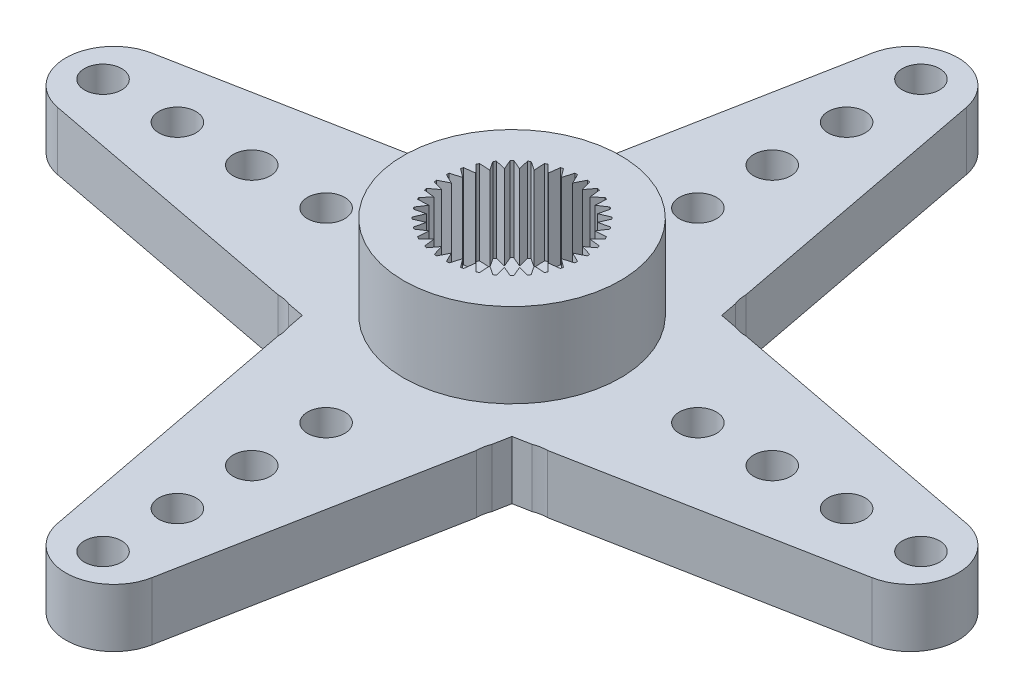
from build123d import *

# Parameters (mm, degrees)
BOSS_EXTRUDE1_DEPTH                                = 2.35
CUT_EXTRUDE1_DEPTH                                 = 2.35
CUT_EXTRUDE2_DEPTH                                 = 2.35
CUT_EXTRUDE3_DEPTH                                 = 2.35
CUT_EXTRUDE4_DEPTH                                 = 2.35
CUT_EXTRUDE5_DEPTH                                 = 2.35
CUT_EXTRUDE6_DEPTH                                 = 2.35
CUT_EXTRUDE7_DEPTH                                 = 2.35
CUT_EXTRUDE8_DEPTH                                 = 2.35
SKETCH10_R                                         = 4.375
BOSS_EXTRUDE2_DEPTH                                = 3.4
CUT_EXTRUDE9_DEPTH                                 = 3.4
F_8_8_8_8_DIAMETER_HOLE1_D                         = 8.8
F_8_8_8_8_DIAMETER_HOLE1_DEPTH                     = 0.3
SKETCH14_W                                         = 3.25
SKETCH14_H                                         = 0.3
F_1_5_1_5_DIAMETER_HOLE1_D                         = 1.5
CBORE_FOR_M2_5_HEX_HEAD_MACHINE_SCREW1_D           = 3
CBORE_FOR_M2_5_HEX_HEAD_MACHINE_SCREW1_DEPTH       = 5.75
CBORE_FOR_M2_5_HEX_HEAD_MACHINE_SCREW1_CBORE_D     = 5.5
CBORE_FOR_M2_5_HEX_HEAD_MACHINE_SCREW1_CBORE_DEPTH = 0.3


with BuildPart() as part:
    # Sketch1 → Boss-Extrude1 (new body)
    with BuildSketch(Plane(origin=(0, 2.35, 0), x_dir=(1, 0, 0), z_dir=(0, 1, 0))):
        with BuildLine():
            Line((-16.428641042, -1.9), (-4.230530925, -4.230530925))
            Line((-4.230530925, -4.230530925), (-1.9, -16.428641042))
            ThreePointArc((-1.9, -16.428641042), (0, -18), (1.9, -16.428641042))
            Line((1.9, -16.428641042), (4.230530925, -4.230530925))
            Line((4.230530925, -4.230530925), (16.428641042, -1.9))
            ThreePointArc((16.428641042, -1.9), (18, 0), (16.428641042, 1.9))
            Line((16.428641042, 1.9), (4.230530925, 4.230530925))
            Line((4.230530925, 4.230530925), (1.9, 16.428641042))
            ThreePointArc((1.9, 16.428641042), (0, 18), (-1.9, 16.428641042))
            Line((-1.9, 16.428641042), (-4.230530925, 4.230530925))
            Line((-4.230530925, 4.230530925), (-16.428641042, 1.9))
            ThreePointArc((-16.428641042, 1.9), (-18, 0), (-16.428641042, -1.9))
        make_face()
    extrude(amount=-BOSS_EXTRUDE1_DEPTH)

    # Sketch2 → Cut-Extrude1 (cut)
    with BuildSketch(Plane.XZ):
        with BuildLine():
            Line((4.101224008, 4.907329504), (4, 5.437140793))
            ThreePointArc((4, 5.437140793), (4.025532815, 5.167443601), (4.101224008, 4.907329504))
        make_face()
    extrude(amount=-CUT_EXTRUDE1_DEPTH, mode=Mode.SUBTRACT)

    # Sketch3 → Cut-Extrude2 (cut)
    with BuildSketch(Plane.XZ):
        with BuildLine():
            Line((5.437140793, 4), (4.907329504, 4.101224008))
            ThreePointArc((4.907329504, 4.101224008), (5.167443601, 4.025532815), (5.437140793, 4))
        make_face()
    extrude(amount=-CUT_EXTRUDE2_DEPTH, mode=Mode.SUBTRACT)

    # Sketch4 → Cut-Extrude3 (cut)
    with BuildSketch(Plane.XZ):
        with BuildLine():
            Line((4.907329504, -4.101224008), (5.437140793, -4))
            ThreePointArc((5.437140793, -4), (5.167443601, -4.025532815), (4.907329504, -4.101224008))
        make_face()
    extrude(amount=-CUT_EXTRUDE3_DEPTH, mode=Mode.SUBTRACT)

    # Sketch5 → Cut-Extrude4 (cut)
    with BuildSketch(Plane.XZ):
        with BuildLine():
            Line((4, -5.437140793), (4.101224008, -4.907329504))
            ThreePointArc((4.101224008, -4.907329504), (4.025532815, -5.167443601), (4, -5.437140793))
        make_face()
    extrude(amount=-CUT_EXTRUDE4_DEPTH, mode=Mode.SUBTRACT)

    # Sketch6 → Cut-Extrude5 (cut)
    with BuildSketch(Plane.XZ):
        with BuildLine():
            Line((-4.101224008, -4.907329504), (-4, -5.437140793))
            ThreePointArc((-4, -5.437140793), (-4.025532815, -5.167443601), (-4.101224008, -4.907329504))
        make_face()
    extrude(amount=-CUT_EXTRUDE5_DEPTH, mode=Mode.SUBTRACT)

    # Sketch7 → Cut-Extrude6 (cut)
    with BuildSketch(Plane.XZ):
        with BuildLine():
            Line((-5.437140793, -4), (-4.907329504, -4.101224008))
            ThreePointArc((-4.907329504, -4.101224008), (-5.167443601, -4.025532815), (-5.437140793, -4))
        make_face()
    extrude(amount=-CUT_EXTRUDE6_DEPTH, mode=Mode.SUBTRACT)

    # Sketch8 → Cut-Extrude7 (cut)
    with BuildSketch(Plane.XZ):
        with BuildLine():
            Line((-4.907329504, 4.101224008), (-5.437140793, 4))
            ThreePointArc((-5.437140793, 4), (-5.167443601, 4.025532815), (-4.907329504, 4.101224008))
        make_face()
    extrude(amount=-CUT_EXTRUDE7_DEPTH, mode=Mode.SUBTRACT)

    # Sketch9 → Cut-Extrude8 (cut)
    with BuildSketch(Plane.XZ):
        with BuildLine():
            Line((-4, 5.437140793), (-4.101224008, 4.907329504))
            ThreePointArc((-4.101224008, 4.907329504), (-4.025532815, 5.167443601), (-4, 5.437140793))
        make_face()
    extrude(amount=-CUT_EXTRUDE8_DEPTH, mode=Mode.SUBTRACT)

    # Sketch10 → Boss-Extrude2 (add)
    with BuildSketch(Plane(origin=(0, 2.35, 0), x_dir=(-1, 0, 0), z_dir=(0, 1, 0))):
        with Locations(Location((0, 0, 0), (0, 0, 90))):
            Circle(SKETCH10_R)
    extrude(amount=BOSS_EXTRUDE2_DEPTH)

    # Sketch11 → Cut-Extrude9 (cut)
    with BuildSketch(Plane(origin=(0, 5.75, 0), x_dir=(-1, 0, 0), z_dir=(0, 1, 0))):
        with BuildLine():
            Line((0.687336745, 2.765875666), (0.425438035, 2.412778995))
            Line((0.425438035, 2.412778995), (0.300099924, 2.834155965))
            ThreePointArc((0.300099924, 2.834155965), (0.248393867, 2.83915489), (0.196605286, 2.843210573))
            Line((0.196605286, 2.843210573), (0, 2.45))
            Line((0, 2.45), (-0.196605286, 2.843210573))
            ThreePointArc((-0.196605286, 2.843210573), (-0.248393867, 2.83915489), (-0.300099924, 2.834155965))
            Line((-0.300099924, 2.834155965), (-0.425438035, 2.412778995))
            Line((-0.425438035, 2.412778995), (-0.687336745, 2.765875666))
            ThreePointArc((-0.687336745, 2.765875666), (-0.737634279, 2.752888605), (-0.787686751, 2.738986963))
            Line((-0.787686751, 2.738986963), (-0.837949351, 2.302246921))
            Line((-0.837949351, 2.302246921), (-1.157183824, 2.604501026))
            ThreePointArc((-1.157183824, 2.604501026), (-1.204462046, 2.582977193), (-1.251340114, 2.560595228))
            Line((-1.251340114, 2.560595228), (-1.225, 2.121762239))
            Line((-1.225, 2.121762239), (-1.591870459, 2.363989941))
            ThreePointArc((-1.591870459, 2.363989941), (-1.634692844, 2.334583326), (-1.676972141, 2.304401102))
            Line((-1.676972141, 2.304401102), (-1.574829644, 1.876808886))
            Line((-1.574829644, 1.876808886), (-1.978188915, 2.051650218))
            ThreePointArc((-1.978188915, 2.051650218), (-2.015254326, 2.015254326), (-2.051650218, 1.978188915))
            Line((-2.051650218, 1.978188915), (-1.876808886, 1.574829644))
            Line((-1.876808886, 1.574829644), (-2.304401102, 1.676972141))
            ThreePointArc((-2.304401102, 1.676972141), (-2.334583326, 1.634692844), (-2.363989941, 1.591870459))
            Line((-2.363989941, 1.591870459), (-2.121762239, 1.225))
            Line((-2.121762239, 1.225), (-2.560595228, 1.251340114))
            ThreePointArc((-2.560595228, 1.251340114), (-2.582977193, 1.204462046), (-2.604501026, 1.157183824))
            Line((-2.604501026, 1.157183824), (-2.302246921, 0.837949351))
            Line((-2.302246921, 0.837949351), (-2.738986963, 0.787686751))
            ThreePointArc((-2.738986963, 0.787686751), (-2.752888605, 0.737634279), (-2.765875666, 0.687336745))
            Line((-2.765875666, 0.687336745), (-2.412778995, 0.425438035))
            Line((-2.412778995, 0.425438035), (-2.834155965, 0.300099924))
            ThreePointArc((-2.834155965, 0.300099924), (-2.83915489, 0.248393867), (-2.843210573, 0.196605286))
            Line((-2.843210573, 0.196605286), (-2.45, 0))
            Line((-2.45, 0), (-2.843210573, -0.196605286))
            ThreePointArc((-2.843210573, -0.196605286), (-2.83915489, -0.248393867), (-2.834155965, -0.300099924))
            Line((-2.834155965, -0.300099924), (-2.412778995, -0.425438035))
            Line((-2.412778995, -0.425438035), (-2.765875666, -0.687336745))
            ThreePointArc((-2.765875666, -0.687336745), (-2.752888605, -0.737634279), (-2.738986963, -0.787686751))
            Line((-2.738986963, -0.787686751), (-2.302246921, -0.837949351))
            Line((-2.302246921, -0.837949351), (-2.604501026, -1.157183824))
            ThreePointArc((-2.604501026, -1.157183824), (-2.582977193, -1.204462046), (-2.560595228, -1.251340114))
            Line((-2.560595228, -1.251340114), (-2.121762239, -1.225))
            Line((-2.121762239, -1.225), (-2.363989941, -1.591870459))
            ThreePointArc((-2.363989941, -1.591870459), (-2.334583326, -1.634692844), (-2.304401102, -1.676972141))
            Line((-2.304401102, -1.676972141), (-1.876808886, -1.574829644))
            Line((-1.876808886, -1.574829644), (-2.051650218, -1.978188915))
            ThreePointArc((-2.051650218, -1.978188915), (-2.015254326, -2.015254326), (-1.978188915, -2.051650218))
            Line((-1.978188915, -2.051650218), (-1.574829644, -1.876808886))
            Line((-1.574829644, -1.876808886), (-1.676972141, -2.304401102))
            ThreePointArc((-1.676972141, -2.304401102), (-1.634692844, -2.334583326), (-1.591870459, -2.363989941))
            Line((-1.591870459, -2.363989941), (-1.225, -2.121762239))
            Line((-1.225, -2.121762239), (-1.251340114, -2.560595228))
            ThreePointArc((-1.251340114, -2.560595228), (-1.204462046, -2.582977193), (-1.157183824, -2.604501026))
            Line((-1.157183824, -2.604501026), (-0.837949351, -2.302246921))
            Line((-0.837949351, -2.302246921), (-0.787686751, -2.738986963))
            ThreePointArc((-0.787686751, -2.738986963), (-0.737634279, -2.752888605), (-0.687336745, -2.765875666))
            Line((-0.687336745, -2.765875666), (-0.425438035, -2.412778995))
            Line((-0.425438035, -2.412778995), (-0.300099924, -2.834155965))
            ThreePointArc((-0.300099924, -2.834155965), (-0.248393867, -2.83915489), (-0.196605286, -2.843210573))
            Line((-0.196605286, -2.843210573), (0, -2.45))
            Line((0, -2.45), (0.196605286, -2.843210573))
            ThreePointArc((0.196605286, -2.843210573), (0.248393867, -2.83915489), (0.300099924, -2.834155965))
            Line((0.300099924, -2.834155965), (0.425438035, -2.412778995))
            Line((0.425438035, -2.412778995), (0.687336745, -2.765875666))
            ThreePointArc((0.687336745, -2.765875666), (0.737634279, -2.752888605), (0.787686751, -2.738986963))
            Line((0.787686751, -2.738986963), (0.837949351, -2.302246921))
            Line((0.837949351, -2.302246921), (1.157183824, -2.604501026))
            ThreePointArc((1.157183824, -2.604501026), (1.204462046, -2.582977193), (1.251340114, -2.560595228))
            Line((1.251340114, -2.560595228), (1.225, -2.121762239))
            Line((1.225, -2.121762239), (1.591870459, -2.363989941))
            ThreePointArc((1.591870459, -2.363989941), (1.634692844, -2.334583326), (1.676972141, -2.304401102))
            Line((1.676972141, -2.304401102), (1.574829644, -1.876808886))
            Line((1.574829644, -1.876808886), (1.978188915, -2.051650218))
            ThreePointArc((1.978188915, -2.051650218), (2.015254326, -2.015254326), (2.051650218, -1.978188915))
            Line((2.051650218, -1.978188915), (1.876808886, -1.574829644))
            Line((1.876808886, -1.574829644), (2.304401102, -1.676972141))
            ThreePointArc((2.304401102, -1.676972141), (2.334583326, -1.634692844), (2.363989941, -1.591870459))
            Line((2.363989941, -1.591870459), (2.121762239, -1.225))
            Line((2.121762239, -1.225), (2.560595228, -1.251340114))
            ThreePointArc((2.560595228, -1.251340114), (2.582977193, -1.204462046), (2.604501026, -1.157183824))
            Line((2.604501026, -1.157183824), (2.302246921, -0.837949351))
            Line((2.302246921, -0.837949351), (2.738986963, -0.787686751))
            ThreePointArc((2.738986963, -0.787686751), (2.752888605, -0.737634279), (2.765875666, -0.687336745))
            Line((2.765875666, -0.687336745), (2.412778995, -0.425438035))
            Line((2.412778995, -0.425438035), (2.834155965, -0.300099924))
            ThreePointArc((2.834155965, -0.300099924), (2.83915489, -0.248393867), (2.843210573, -0.196605286))
            Line((2.843210573, -0.196605286), (2.45, 0))
            Line((2.45, 0), (2.843210573, 0.196605286))
            ThreePointArc((2.843210573, 0.196605286), (2.83915489, 0.248393867), (2.834155965, 0.300099924))
            Line((2.834155965, 0.300099924), (2.412778995, 0.425438035))
            Line((2.412778995, 0.425438035), (2.765875666, 0.687336745))
            ThreePointArc((2.765875666, 0.687336745), (2.752888605, 0.737634279), (2.738986963, 0.787686751))
            Line((2.738986963, 0.787686751), (2.302246921, 0.837949351))
            Line((2.302246921, 0.837949351), (2.604501026, 1.157183824))
            ThreePointArc((2.604501026, 1.157183824), (2.582977193, 1.204462046), (2.560595228, 1.251340114))
            Line((2.560595228, 1.251340114), (2.121762239, 1.225))
            Line((2.121762239, 1.225), (2.363989941, 1.591870459))
            ThreePointArc((2.363989941, 1.591870459), (2.334583326, 1.634692844), (2.304401102, 1.676972141))
            Line((2.304401102, 1.676972141), (1.876808886, 1.574829644))
            Line((1.876808886, 1.574829644), (2.051650218, 1.978188915))
            ThreePointArc((2.051650218, 1.978188915), (2.015254326, 2.015254326), (1.978188915, 2.051650218))
            Line((1.978188915, 2.051650218), (1.574829644, 1.876808886))
            Line((1.574829644, 1.876808886), (1.676972141, 2.304401102))
            ThreePointArc((1.676972141, 2.304401102), (1.634692844, 2.334583326), (1.591870459, 2.363989941))
            Line((1.591870459, 2.363989941), (1.225, 2.121762239))
            Line((1.225, 2.121762239), (1.251340114, 2.560595228))
            ThreePointArc((1.251340114, 2.560595228), (1.204462046, 2.582977193), (1.157183824, 2.604501026))
            Line((1.157183824, 2.604501026), (0.837949351, 2.302246921))
            Line((0.837949351, 2.302246921), (0.787686751, 2.738986963))
            ThreePointArc((0.787686751, 2.738986963), (0.737634279, 2.752888605), (0.687336745, 2.765875666))
        make_face()
    extrude(amount=-CUT_EXTRUDE9_DEPTH, mode=Mode.SUBTRACT)

    # Ø8.8 (8.8) Diameter Hole1
    with Locations(Plane(origin=(0, 0, 0), x_dir=(-1, 0, 0), z_dir=(0, -1, 0))):
        with Locations((0, 0)):
            Hole(F_8_8_8_8_DIAMETER_HOLE1_D / 2, depth=F_8_8_8_8_DIAMETER_HOLE1_DEPTH)

    # Sketch14 → Revolve1 (revolve)
    with BuildSketch(Plane.XY, mode=Mode.PRIVATE) as revolve1_sk:
        with Locations((1.625, 0.15)):
            Rectangle(SKETCH14_W, SKETCH14_H)
    revolve(revolve1_sk.sketch.rotate(Axis((0, 0.3, 0), (0, -1, 0)), 270), axis=Axis((0, 0.3, 0), (0, -1, 0)))

    # Ø1.5 (1.5) Diameter Hole1 (through all)
    with Locations(Plane(origin=(0, 2.35, 0), x_dir=(1, 0, 0), z_dir=(0, 1, 0))):
        with Locations((0, -7.5), (0, -10.5), (0, -13.5), (0, -16.5), (7.5, 0), (10.5, 0), (13.5, 0), (16.5, 0), (0, 7.5), (0, 10.5), (0, 13.5), (0, 16.5), (-7.5, 0), (-10.5, 0), (-13.5, 0), (-16.5, 0)):
            Hole(F_1_5_1_5_DIAMETER_HOLE1_D / 2)

    # CBORE for M2.5 Hex Head Machine Screw1
    with Locations(Plane(origin=(0, 0, 0), x_dir=(-1, 0, 0), z_dir=(0, -1, 0))):
        with Locations((0, 0)):
            CounterBoreHole(CBORE_FOR_M2_5_HEX_HEAD_MACHINE_SCREW1_D / 2, CBORE_FOR_M2_5_HEX_HEAD_MACHINE_SCREW1_CBORE_D / 2, CBORE_FOR_M2_5_HEX_HEAD_MACHINE_SCREW1_CBORE_DEPTH, depth=CBORE_FOR_M2_5_HEX_HEAD_MACHINE_SCREW1_DEPTH)


solid = part.part
